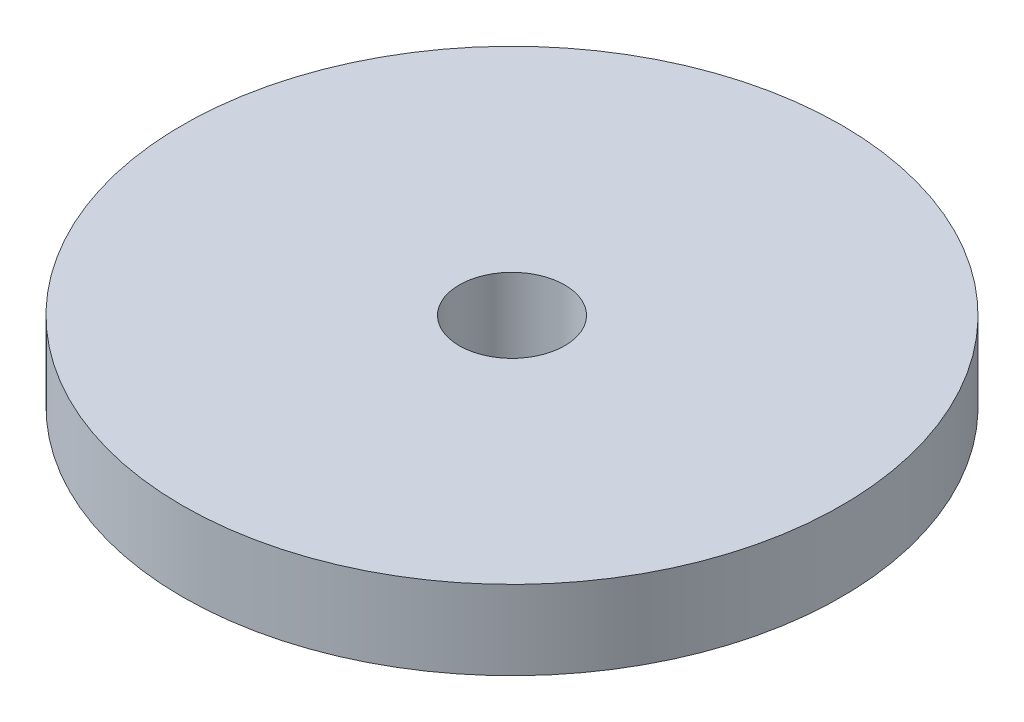
from build123d import *

# Parameters (mm, degrees)
SKETCH1_R           = 12.5
SKETCH1_R_2         = 2
BOSS_EXTRUDE1_DEPTH = 3


with BuildPart() as part:
    # Sketch1 → Boss-Extrude1 (new body)
    with BuildSketch(Plane(origin=(0, 0, 0), x_dir=(1, 0, 0), z_dir=(0, 1, 0))):
        with Locations(Location((0, 0, 0), (0, 0, 270))):
            Circle(SKETCH1_R)
        with Locations(Location((0, 0, 0), (0, 0, 270))):
            Circle(SKETCH1_R_2, mode=Mode.SUBTRACT)
    extrude(amount=BOSS_EXTRUDE1_DEPTH)


solid = part.part
